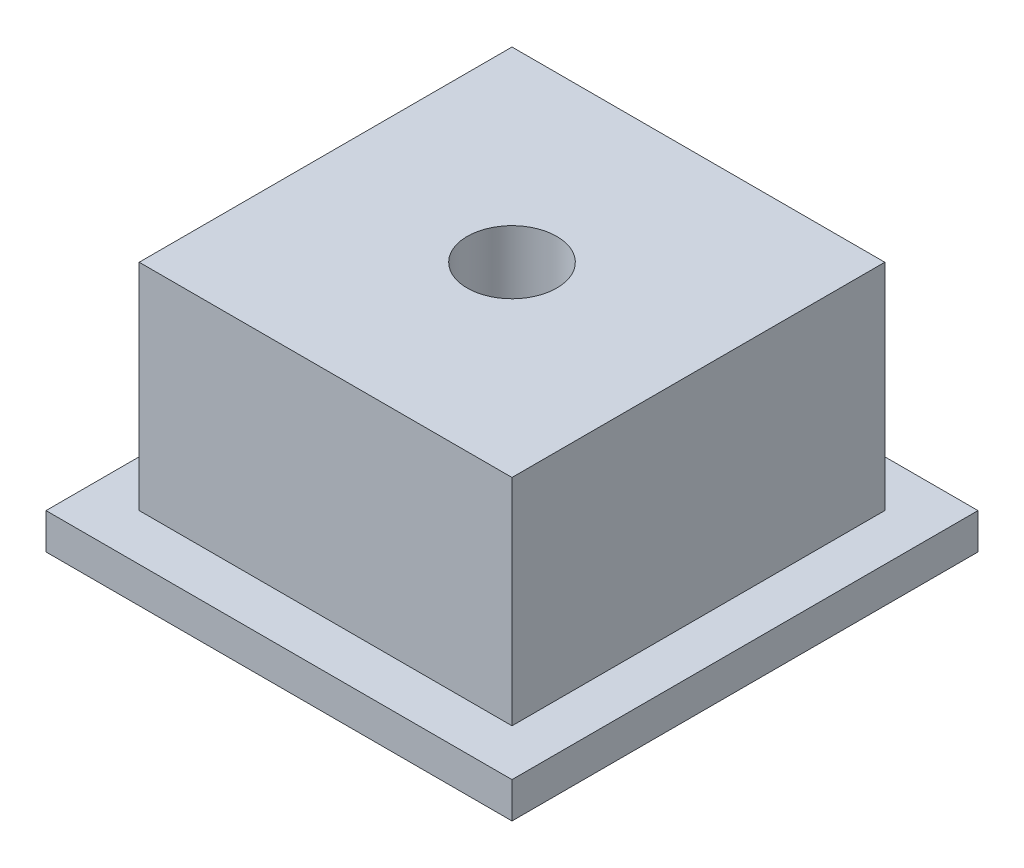
from build123d import *

# Parameters (mm, degrees)
SKETCH1_W           = 13
SKETCH1_H           = 13
BOSS_EXTRUDE1_DEPTH = 1
SKETCH2_W           = 10.4
SKETCH2_H           = 10.4
BOSS_EXTRUDE2_DEPTH = 6
SKETCH3_R           = 4.5
CUT_EXTRUDE1_DEPTH  = 4
SKETCH4_R           = 1.25
CUT_EXTRUDE2_DEPTH  = 11.024968828


with BuildPart() as part:
    # Sketch1 → Boss-Extrude1 (new body)
    with BuildSketch(Plane(origin=(0, 0, 0), x_dir=(1, 0, 0), z_dir=(0, 1, 0))):
        Rectangle(SKETCH1_W, SKETCH1_H)
    extrude(amount=BOSS_EXTRUDE1_DEPTH)

    # Sketch2 → Boss-Extrude2 (add)
    with BuildSketch(Plane(origin=(0, 1, 0), x_dir=(1, 0, 0), z_dir=(0, 1, 0))):
        Rectangle(SKETCH2_W, SKETCH2_H)
    extrude(amount=BOSS_EXTRUDE2_DEPTH)

    # Sketch3 → Cut-Extrude1 (cut)
    with BuildSketch(Plane.XZ):
        with Locations(Location((0, 0, 0), (0, 0, 270))):
            Circle(SKETCH3_R)
    extrude(amount=-CUT_EXTRUDE1_DEPTH, mode=Mode.SUBTRACT)

    # Sketch4 → Cut-Extrude2 (cut, through all)
    with BuildSketch(Plane.XZ.offset(-4)):
        with Locations(Location((0, 0, 0), (0, 0, 270))):
            Circle(SKETCH4_R)
    extrude(amount=-CUT_EXTRUDE2_DEPTH, mode=Mode.SUBTRACT)


solid = part.part
